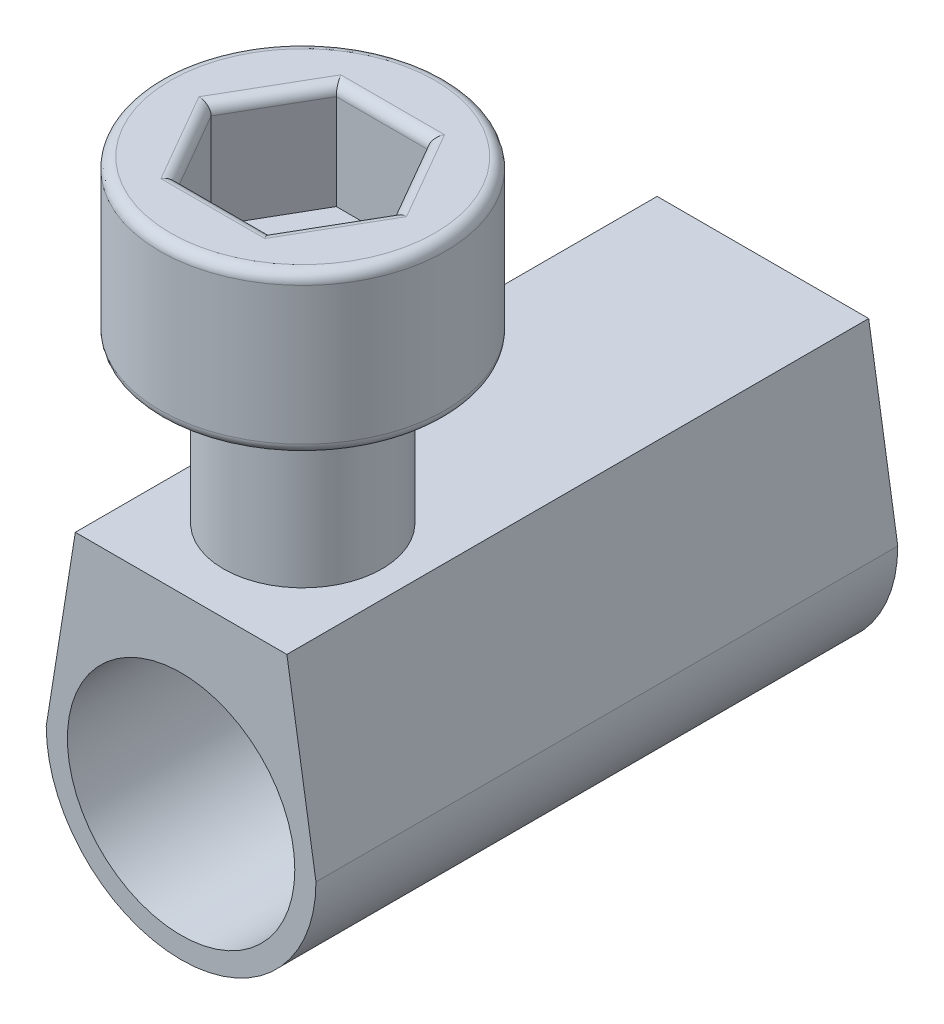
from build123d import *

# Parameters (mm, degrees)
SKETCH_1_R               = 2.15
EXTRUDE_1_DEPTH          = 11
CUT_EXTRUDE_1_REACH      = 14.787
CUT_EXTRUDE_1_END_RADIUS = 2.15
SKETCH_2_R               = 1.5
EXTRUDE_2_DEPTH          = 3
EXTRUDE_2_DEPTH_BACK     = 2
SKETCH_3_R               = 1.5
SKETCH_4_R               = 2.7
EXTRUDE_3_DEPTH          = 3
CUT_EXTRUDE_2_DEPTH      = 2
FILLET_1_R               = 0.2


with BuildPart() as part:
    # Эскиз1 → Бобышка-Вытянуть1 (new body)
    with BuildSketch(Plane.XY):
        with BuildLine():
            Line((-2, 6), (2, 6))
            Line((2, 6), (2.55, 2.55))
            ThreePointArc((2.55, 2.55), (0, 0), (-2.55, 2.55))
            Line((-2.55, 2.55), (-2, 6))
        make_face()
        with Locations((0, 2.55)):
            Circle(SKETCH_1_R, mode=Mode.SUBTRACT)
    extrude(amount=-EXTRUDE_1_DEPTH)

    # Вырез-Вытянуть1: up to this cylinder (the profile starts outside it)
    cut_extrude_1_end = Plane(origin=(0, 2.55, -2.3), z_dir=(0, 0, 1)) * Cylinder(CUT_EXTRUDE_1_END_RADIUS, 34.874, mode=Mode.PRIVATE)
    # Эскиз2 → Вырез-Вытянуть1 (cut, up to the surface)
    with BuildSketch(Plane(origin=(0, 6, 0), x_dir=(1, 0, 0), z_dir=(0, 1, 0)), mode=Mode.PRIVATE) as cut_extrude_1_sk1:
        with Locations(Location((0, 2.3, 0), (0, 0, 270))):
            Circle(SKETCH_2_R)
    cut_extrude_1_tool1 = extrude(cut_extrude_1_sk1.sketch, amount=-CUT_EXTRUDE_1_REACH, mode=Mode.PRIVATE) - cut_extrude_1_end
    add(cut_extrude_1_tool1.solids().sort_by_distance((0, 6, -2.3))[0], mode=Mode.SUBTRACT)


with BuildPart() as body_2:
    # Эскиз3 → Бобышка-Вытянуть2 (new, two sides: drawn at the far end of the back side and taken through both)
    with BuildSketch(Plane(origin=(0, 6, 0), x_dir=(1, 0, 0), z_dir=(0, 1, 0)).offset(-EXTRUDE_2_DEPTH_BACK)):
        with Locations(Location((0, 2.3, 0), (0, 0, 270))):
            Circle(SKETCH_3_R)
    extrude(amount=EXTRUDE_2_DEPTH + EXTRUDE_2_DEPTH_BACK)

    # Эскиз4 → Бобышка-Вытянуть3 (add)
    with BuildSketch(Plane(origin=(0, 9, 0), x_dir=(1, 0, 0), z_dir=(0, 1, 0))):
        with Locations(Location((0, 2.3, 0), (0, 0, 270))):
            Circle(SKETCH_4_R)
    extrude(amount=EXTRUDE_3_DEPTH)

    # Эскиз5 → Вырез-Вытянуть2 (cut)
    with BuildSketch(Plane(origin=(0, 12, 0), x_dir=(1, 0, 0), z_dir=(0, 1, 0))):
        Polygon((1.732050808, 2.3), (0.866025404, 3.8), (-0.866025404, 3.8), (-1.732050808, 2.3), (-0.866025404, 0.8), (0.866025404, 0.8), align=None)
    extrude(amount=-CUT_EXTRUDE_2_DEPTH, mode=Mode.SUBTRACT)

    # Скругление1
    fillet_1_edges = [body_2.edges().sort_by_distance(p)[0] for p in [
        (1.299038106, 12, -1.55),
        (1.299038106, 12, -3.05),
        (0, 12, -3.8),
        (-1.299038106, 12, -3.05),
        (-1.299038106, 12, -1.55),
        (0, 12, -0.8),
        (0, 9, -3.8),
        (0, 9, -5),
        (0, 12, -5),
    ]]
    fillet(fillet_1_edges, radius=FILLET_1_R)


solid = Compound([part.part, body_2.part])
